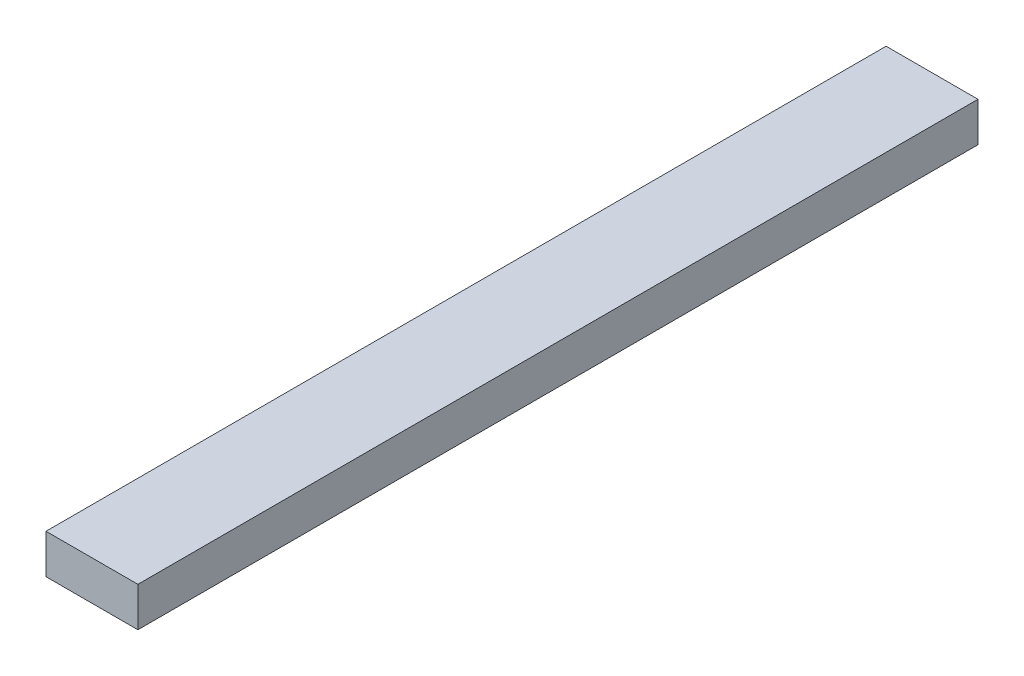
from build123d import *

# Parameters (mm, degrees)
SKETCH1_W           = 88.9
SKETCH1_H           = 38.1
BOSS_EXTRUDE1_DEPTH = 812.8


with BuildPart() as part:
    # Sketch1 → Boss-Extrude1 (new body)
    with BuildSketch(Plane.XY):
        with Locations((44.45, 19.05)):
            Rectangle(SKETCH1_W, SKETCH1_H)
    extrude(amount=BOSS_EXTRUDE1_DEPTH)


solid = part.part
